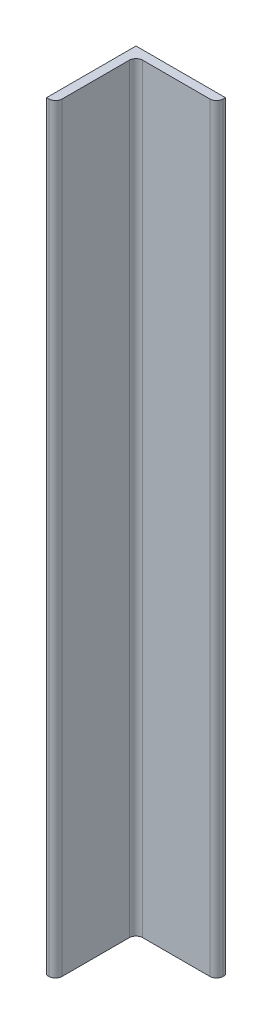
from build123d import *

# Parameters (mm, degrees)
BOSS_EXTRUDE1_DEPTH = 340


with BuildPart() as part:
    # Sketch1 → Boss-Extrude1 (new body)
    with BuildSketch(Plane(origin=(0, 0, 0), x_dir=(1, 0, 0), z_dir=(0, 1, 0))):
        with BuildLine():
            Line((-27.499872145, 29.213153277), (-67.499872145, 29.213153277))
            Line((-67.499872145, 29.213153277), (-67.499872145, -10.786846723))
            Line((-67.499872145, -10.786846723), (-66.499872145, -10.786846723))
            ThreePointArc((-66.499872145, -10.786846723), (-64.378551801, -9.908167067), (-63.499872145, -7.786846723))
            Line((-63.499872145, -7.786846723), (-63.499872145, 22.213153277))
            ThreePointArc((-63.499872145, 22.213153277), (-62.621192489, 24.334473621), (-60.499872145, 25.213153277))
            Line((-60.499872145, 25.213153277), (-30.499872145, 25.213153277))
            ThreePointArc((-30.499872145, 25.213153277), (-28.378551801, 26.091832933), (-27.499872145, 28.213153277))
            Line((-27.499872145, 28.213153277), (-27.499872145, 29.213153277))
        make_face()
    extrude(amount=BOSS_EXTRUDE1_DEPTH)


solid = part.part
